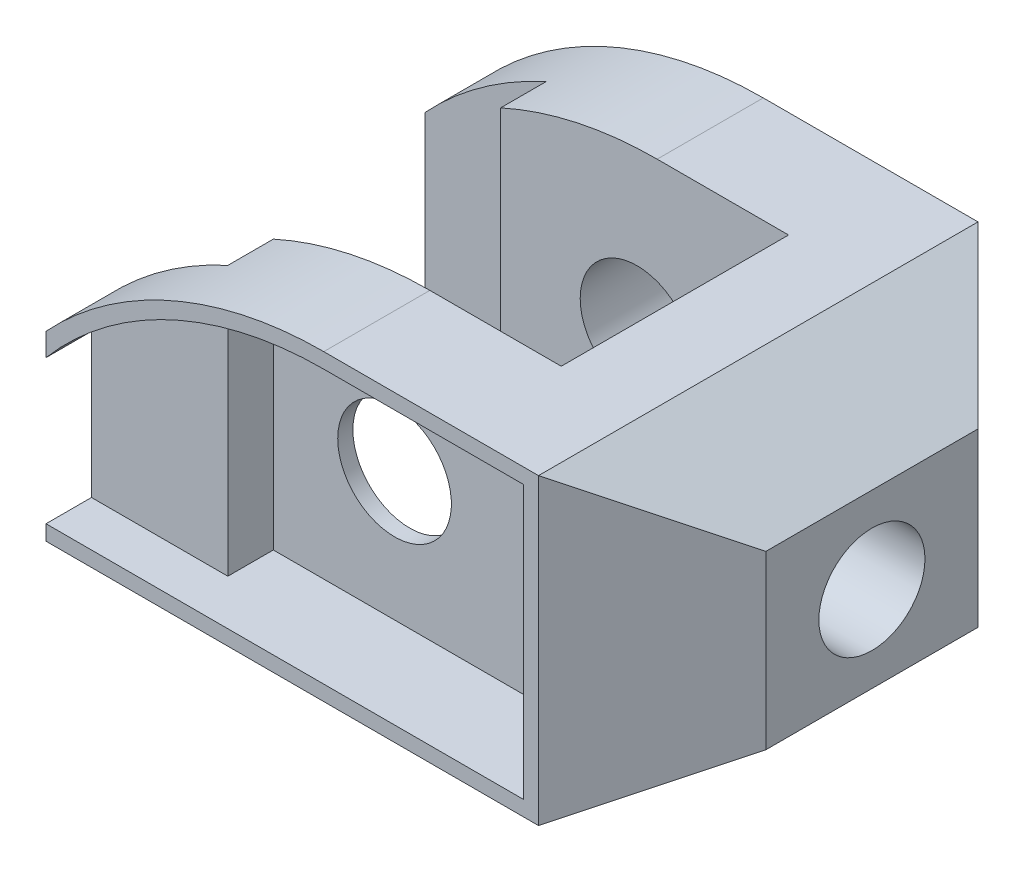
from build123d import *

# Parameters (mm, degrees)
SKETCH1_R               = 7.5
BOSS_EXTRUDE1_DEPTH     = 29
CUT_EXTRUDE1_DEPTH      = 72
CUT_EXTRUDE1_DEPTH_BACK = 95.026591983
CUT_EXTRUDE2_DEPTH      = 72
CUT_EXTRUDE3_DEPTH      = 95.026591983
CUT_EXTRUDE3_DEPTH_BACK = 95.026591983
SKETCH4_R               = 7
CUT_EXTRUDE5_START      = -12
SKETCH5_R               = 7.5
CUT_EXTRUDE5_DEPTH      = 12
CUT_EXTRUDE6_START      = -6
CUT_EXTRUDE6_DEPTH      = 6


with BuildPart() as part:
    # Sketch1 → Boss-Extrude1 (new, symmetric)
    with BuildSketch(Plane.XY):
        with BuildLine():
            Line((0, 0), (65, 0))
            Line((65, 0), (80, 8.660254038))
            Line((80, 8.660254038), (80, 31.339745962))
            Line((80, 31.339745962), (65, 40))
            Line((65, 40), (36.66060556, 40))
            ThreePointArc((36.66060556, 40), (16.66060556, 35.82575695), (0, 24))
            Line((0, 24), (0, 0))
        make_face()
        with Locations((34, 19)):
            Circle(SKETCH1_R, mode=Mode.SUBTRACT)
    extrude(amount=BOSS_EXTRUDE1_DEPTH, both=True)

    # Sketch2 → Cut-Extrude1 (cut, two sides: drawn at the far end of the back side and taken through both)
    with BuildSketch(Plane(origin=(0, 0, 0), x_dir=(1, 0, 0), z_dir=(0, 1, 0)).offset(-CUT_EXTRUDE1_DEPTH_BACK)):
        Polygon((0, 21), (16, 21), (16, 15), (54, 15), (54, -15), (16, -15), (16, -21), (0, -21), align=None)
    extrude(amount=CUT_EXTRUDE1_DEPTH + CUT_EXTRUDE1_DEPTH_BACK, mode=Mode.SUBTRACT)

    # Sketch3 → Cut-Extrude2 (cut)
    with BuildSketch(Plane(origin=(0, 0, 0), x_dir=(1, 0, 0), z_dir=(0, 1, 0))):
        Polygon((80, 29), (65, 29), (80, 14), align=None)
        Polygon((65, -29), (80, -14), (80, -29), align=None)
    extrude(amount=CUT_EXTRUDE2_DEPTH, mode=Mode.SUBTRACT)

    # Sketch4 → Cut-Extrude3 (cut, two sides: drawn at the far end of the back side and taken through both)
    with BuildSketch(Plane(origin=(80, 0, 0), x_dir=(0, 0, -1), z_dir=(1, 0, 0)).offset(-CUT_EXTRUDE3_DEPTH_BACK)):
        with Locations((0, 20)):
            Circle(SKETCH4_R)
    extrude(amount=CUT_EXTRUDE3_DEPTH + CUT_EXTRUDE3_DEPTH_BACK, mode=Mode.SUBTRACT)

    # Sketch5 → Cut-Extrude5 (cut)
    with BuildSketch(Plane.XY.offset(29).offset(CUT_EXTRUDE5_START)):
        with BuildLine():
            Line((18, 34.224221872), (18, 2))
            Line((18, 2), (63, 2))
            Line((63, 2), (63, 38))
            Line((63, 38), (36.66060556, 38))
            ThreePointArc((36.66060556, 38), (27.141221384, 37.046586751), (18, 34.224221872))
        make_face()
        with Locations((34, 19)):
            Circle(SKETCH5_R, mode=Mode.SUBTRACT)
    extrude(amount=CUT_EXTRUDE5_DEPTH, mode=Mode.SUBTRACT)

    # Sketch5<4> → Cut-Extrude6 (cut)
    with BuildSketch(Plane.XY.offset(29).offset(CUT_EXTRUDE6_START)):
        with BuildLine():
            Line((0, 20.98386677), (0, 2))
            Line((0, 2), (18, 2))
            Line((18, 2), (18, 34.224221872))
            ThreePointArc((18, 34.224221872), (8.218807959, 28.666059397), (0, 20.98386677))
        make_face()
    extrude(amount=CUT_EXTRUDE6_DEPTH, mode=Mode.SUBTRACT)


solid = part.part
